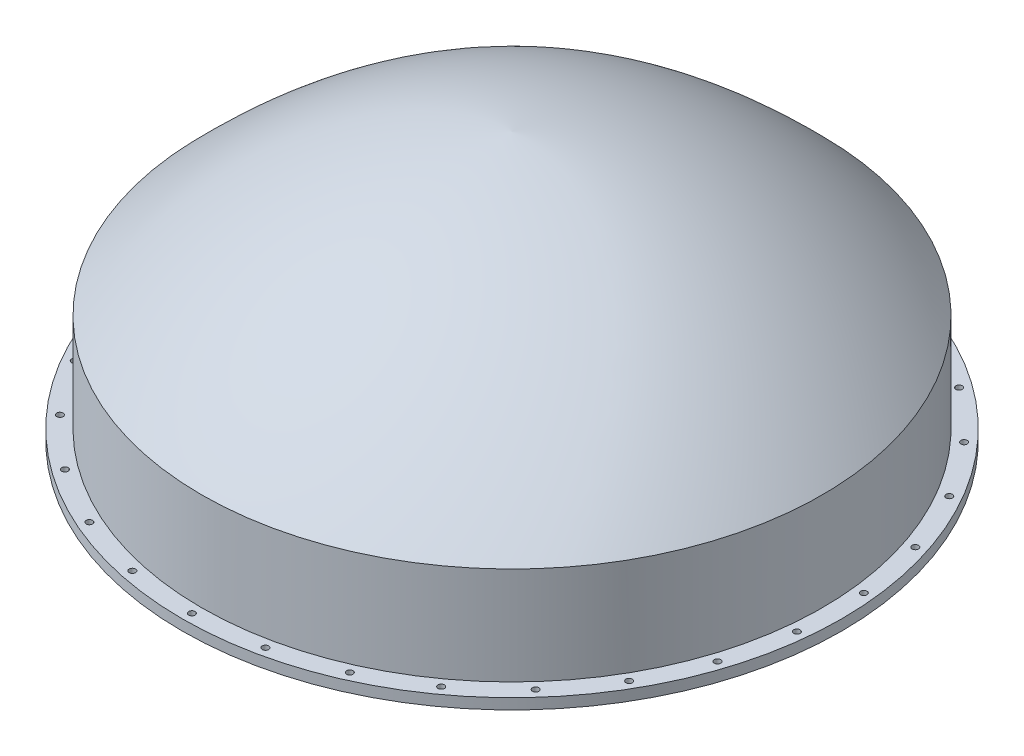
from build123d import *

# Parameters (mm, degrees)
SKETCH7_R          = 22
CUT_EXTRUDE1_DEPTH = 500


with BuildPart() as part:
    # Sketch2 → Revolve3 (revolve)
    with BuildSketch(Plane(origin=(0, 0, 0), x_dir=(0, 0, -1), z_dir=(1, 0, 0))):
        with BuildLine():
            Line((-2081.1295, -171.115), (-2081.1295, 0))
            add(Edge.make_bspline(
                [(-2081.1295, 0), (-1041.865159808, 973.906904547), (0, 1044.41)],
                knots=[0, 0, 0, 1, 1, 1], degree=2))
            Line((0, 1044.41), (0, 1093.3))
            add(Edge.make_bspline(
                [(-2130.0195, 0), (-1162.828995464, 997.365117244), (0, 1093.3)],
                knots=[0, 0, 0, 0.82450401, 0.82450401, 0.82450401], degree=2))
            Line((-2130.0195, 0), (-2130.0195, -171.115))
            Line((-2130.0195, -171.115), (-2130.0195, -671.115))
            Line((-2130.0195, -671.115), (-2262.0195, -671.115))
            Line((-2262.0195, -671.115), (-2262.0195, -744.115))
            Line((-2262.0195, -744.115), (-2081.1295, -744.115))
            Line((-2081.1295, -744.115), (-2081.1295, -171.115))
        make_face()
    revolve(axis=Axis((0, 1093.3, 0), (0, -1, 0)))

    # Sketch7 → Cut-Extrude1 (cut)
    with BuildSketch(Plane.XZ.offset(744.115)):
        with Locations(Location((0, 2196.0195, 0), (0, 0, 270))):
            Circle(SKETCH7_R)
        with Locations(Location((456.578127314, 2148.03120509, 0), (0, 0, 270))):
            Circle(SKETCH7_R)
        with Locations(Location((893.201599559, 2006.16363912, 0), (0, 0, 270))):
            Circle(SKETCH7_R)
        with Locations(Location((1290.787875847, 1776.617095479, 0), (0, 0, 270))):
            Circle(SKETCH7_R)
        with Locations(Location((1631.960528072, 1469.423859611, 0), (0, 0, 270))):
            Circle(SKETCH7_R)
        with Locations(Location((1901.808674206, 1098.00975, 0), (0, 0, 270))):
            Circle(SKETCH7_R)
        with Locations(Location((2088.538655386, 678.607345479, 0), (0, 0, 270))):
            Circle(SKETCH7_R)
        with Locations(Location((2183.989475406, 229.546543641, 0), (0, 0, 270))):
            Circle(SKETCH7_R)
        with Locations(Location((2183.989475406, -229.546543641, 0), (0, 0, 270))):
            Circle(SKETCH7_R)
        with Locations(Location((2088.538655386, -678.607345479, 0), (0, 0, 270))):
            Circle(SKETCH7_R)
        with Locations(Location((1901.808674206, -1098.00975, 0), (0, 0, 270))):
            Circle(SKETCH7_R)
        with Locations(Location((1631.960528072, -1469.423859611, 0), (0, 0, 270))):
            Circle(SKETCH7_R)
        with Locations(Location((1290.787875847, -1776.617095479, 0), (0, 0, 270))):
            Circle(SKETCH7_R)
        with Locations(Location((893.201599559, -2006.16363912, 0), (0, 0, 270))):
            Circle(SKETCH7_R)
        with Locations(Location((456.578127314, -2148.03120509, 0), (0, 0, 270))):
            Circle(SKETCH7_R)
        with Locations(Location((0, -2196.0195, 0), (0, 0, 270))):
            Circle(SKETCH7_R)
        with Locations(Location((-456.578127314, -2148.03120509, 0), (0, 0, 270))):
            Circle(SKETCH7_R)
        with Locations(Location((-893.201599559, -2006.16363912, 0), (0, 0, 270))):
            Circle(SKETCH7_R)
        with Locations(Location((-1290.787875847, -1776.617095479, 0), (0, 0, 270))):
            Circle(SKETCH7_R)
        with Locations(Location((-1631.960528072, -1469.423859611, 0), (0, 0, 270))):
            Circle(SKETCH7_R)
        with Locations(Location((-1901.808674206, -1098.00975, 0), (0, 0, 270))):
            Circle(SKETCH7_R)
        with Locations(Location((-2088.538655386, -678.607345479, 0), (0, 0, 270))):
            Circle(SKETCH7_R)
        with Locations(Location((-2183.989475406, -229.546543641, 0), (0, 0, 270))):
            Circle(SKETCH7_R)
        with Locations(Location((-2183.989475406, 229.546543641, 0), (0, 0, 270))):
            Circle(SKETCH7_R)
        with Locations(Location((-2088.538655386, 678.607345479, 0), (0, 0, 270))):
            Circle(SKETCH7_R)
        with Locations(Location((-1901.808674206, 1098.00975, 0), (0, 0, 270))):
            Circle(SKETCH7_R)
        with Locations(Location((-1631.960528072, 1469.423859611, 0), (0, 0, 270))):
            Circle(SKETCH7_R)
        with Locations(Location((-1290.787875847, 1776.617095479, 0), (0, 0, 270))):
            Circle(SKETCH7_R)
        with Locations(Location((-893.201599559, 2006.16363912, 0), (0, 0, 270))):
            Circle(SKETCH7_R)
        with Locations(Location((-456.578127314, 2148.03120509, 0), (0, 0, 270))):
            Circle(SKETCH7_R)
    extrude(amount=-CUT_EXTRUDE1_DEPTH, mode=Mode.SUBTRACT)


solid = part.part
